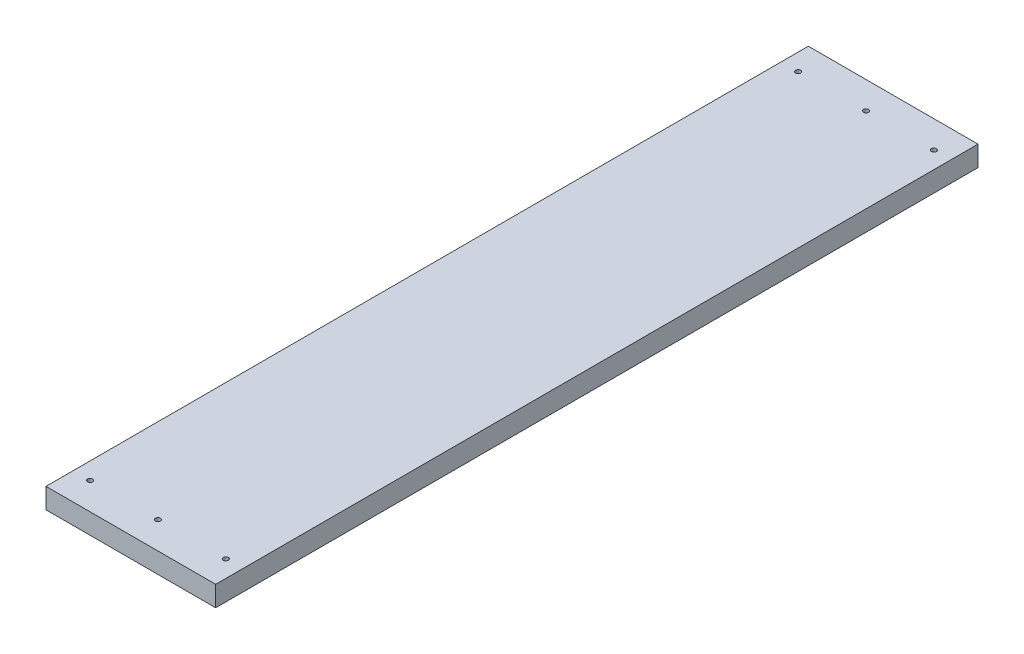
from build123d import *

# Parameters (mm, degrees)
SKETCH1_W                                         = 150
SKETCH1_H                                         = 674
BOSS_EXTRUDE1_DEPTH                               = 9
CSK_FOR_8_FLAT_HEAD_MACHINE_SCREW_100_D           = 4.4958
CSK_FOR_8_FLAT_HEAD_MACHINE_SCREW_100_CSINK_D     = 8.4328
CSK_FOR_8_FLAT_HEAD_MACHINE_SCREW_100_CSINK_ANGLE = 100
F_8_36_TAPPED_HOLE1_AT_2_COUNT                    = 2
F_8_36_TAPPED_HOLE1_AT_2_PITCH                    = 24


with BuildPart() as part:
    # Sketch1 → Boss-Extrude1 (new, symmetric)
    with BuildSketch(Plane(origin=(0, 0, 0), x_dir=(1, 0, 0), z_dir=(0, 1, 0))):
        Rectangle(SKETCH1_W, SKETCH1_H)
    extrude(amount=BOSS_EXTRUDE1_DEPTH, both=True)

    # CSK for #8 Flat Head Machine Screw (100)1 (through all)
    with Locations(Plane(origin=(-75, -9, 0), x_dir=(0, 0, -1), z_dir=(0, -1, 0))):
        with Locations((-313, 135), (-313, 75), (-313, 15)):
            csk_for_8_flat_head_machine_screw_100 = CounterSinkHole(CSK_FOR_8_FLAT_HEAD_MACHINE_SCREW_100_D / 2, CSK_FOR_8_FLAT_HEAD_MACHINE_SCREW_100_CSINK_D / 2, counter_sink_angle=CSK_FOR_8_FLAT_HEAD_MACHINE_SCREW_100_CSINK_ANGLE)

    # Sketch5 → #8-36 Tapped Hole1 (revolve, cut)
    with BuildSketch(Plane(origin=(-75, 0, 249), x_dir=(0, 0, 1), z_dir=(0, 1, 0))):
        Polygon((0, 0), (0, 26.037806461), (1.7272, 25), (1.7272, 0), align=None)
    f_8_36_tapped_hole1 = revolve(axis=Axis((-81.35, 0, 249), (1, 0, 0)), mode=Mode.SUBTRACT)

    # #8-36 Tapped Hole1 at 2: #8-36 Tapped Hole1 ×2
    with Locations(*[(0, 0, -i * F_8_36_TAPPED_HOLE1_AT_2_PITCH) for i in range(1, F_8_36_TAPPED_HOLE1_AT_2_COUNT)]):
        add(f_8_36_tapped_hole1, mode=Mode.SUBTRACT)

    # Mirror1: CSK for #8 Flat Head Machine Screw (100)1, #8-36 Tapped Hole1 across plane
    add(csk_for_8_flat_head_machine_screw_100.mirror(Plane.XY), mode=Mode.SUBTRACT)
    add(f_8_36_tapped_hole1.mirror(Plane.XY), mode=Mode.SUBTRACT)

    # Mirror1 copy 1 sketch → Mirror1 copy 1 (revolve, cut)
    with BuildSketch(Plane(origin=(-75, 0, -225), x_dir=(0, 0, -1), z_dir=(0, 1, 0))):
        Polygon((0, 0), (0, -26.037806461), (1.7272, -25), (1.7272, 0), align=None)
    revolve(axis=Axis((-81.35, 0, -225), (-1, 0, 0)), mode=Mode.SUBTRACT)


solid = part.part
